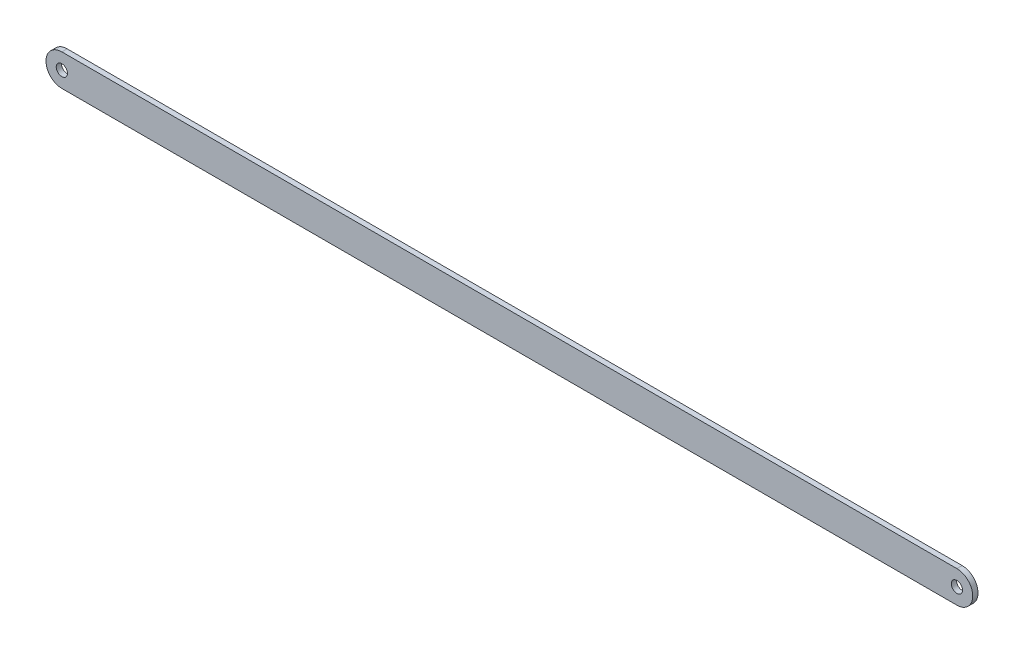
from build123d import *

# Parameters (mm, degrees)
BOSS_EXTRUDE1_DEPTH     = 1.5875
F_1_4_CLEARANCE_HOLE1_D = 6.7564


with BuildPart() as part:
    # Sketch2 → Boss-Extrude1 (new, symmetric)
    with BuildSketch(Plane.XY):
        with BuildLine():
            Line((269.108175275, -9.525), (-269.108175275, -9.525))
            ThreePointArc((-269.108175275, -9.525), (-278.633175275, 0), (-269.108175275, 9.525))
            Line((-269.108175275, 9.525), (269.108175275, 9.525))
            ThreePointArc((269.108175275, 9.525), (278.633175275, 0), (269.108175275, -9.525))
        make_face()
    extrude(amount=BOSS_EXTRUDE1_DEPTH, both=True)

    # 1/4 Clearance Hole1 (through all)
    with Locations(Plane.XY.offset(1.5875)):
        with Locations((-269.108175275, 0), (269.108175275, 0)):
            Hole(F_1_4_CLEARANCE_HOLE1_D / 2)


solid = part.part
